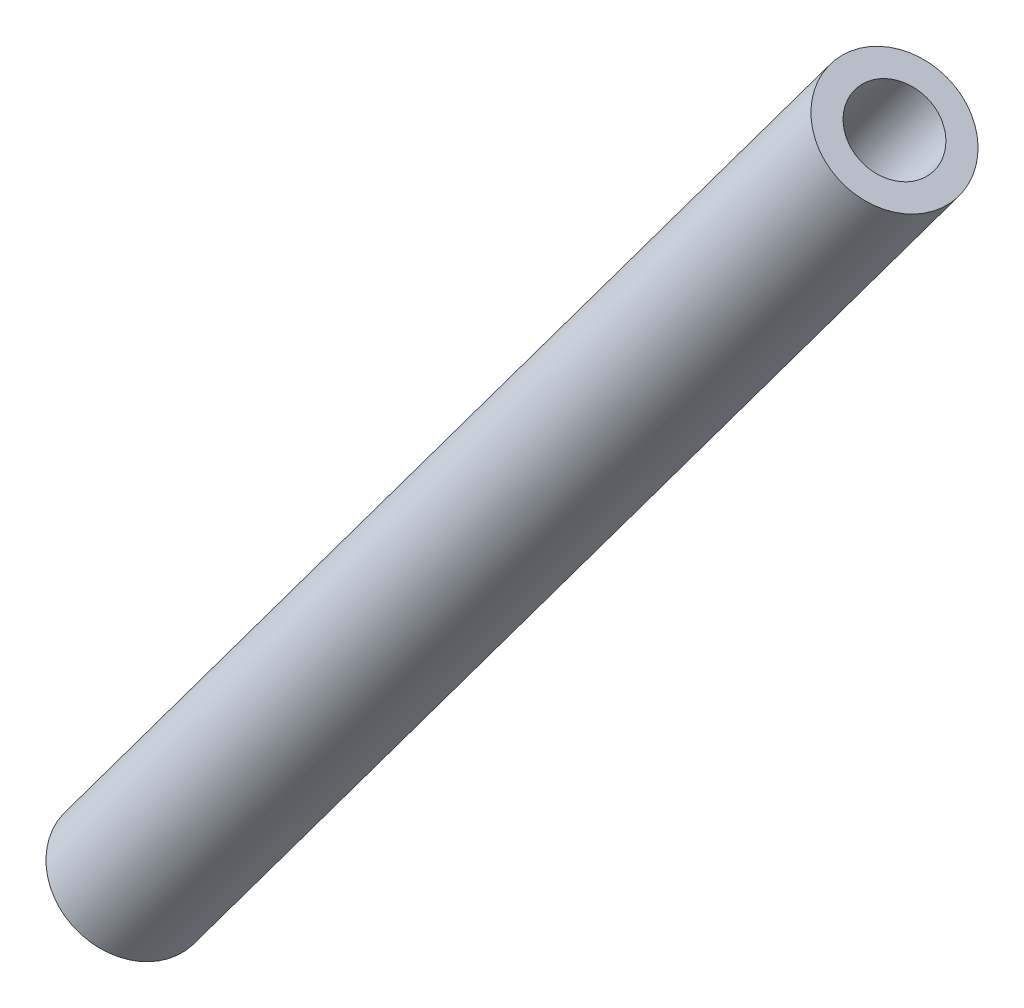
from build123d import *

# Parameters (mm, degrees)
SWEEP1_PROFILE_R     = 10.31875
CUT_SWEEP1_PROFILE_R = 6.35


with BuildPart() as part:
    # Sweep1: sweep along a curve in space
    with BuildLine() as sweep1_path:
        Line((0, 0, 0), (121.160535127, 163.12683632, 0))
    # Sweep1 profile (on start of the path) → Sweep1 (sweep)
    with BuildSketch(Plane(origin=(0, 0, 0), x_dir=(0.8027895488189021, -0.5962624760180233, 0), z_dir=(0.5962624760180233, 0.8027895488189021, 0))):
        Circle(SWEEP1_PROFILE_R)
    sweep(path=sweep1_path.line)

    # Cut-Sweep1: sweep along a curve in space
    with BuildLine() as cut_sweep1_path:
        Line((0, 0, 0), (121.160535127, 163.12683632, 0))
    # Cut-Sweep1 profile (on start of the path) → Cut-Sweep1 (sweep, cut)
    with BuildSketch(Plane(origin=(0, 0, 0), x_dir=(0.8027895488189021, -0.5962624760180233, 0), z_dir=(0.5962624760180233, 0.8027895488189021, 0))):
        Circle(CUT_SWEEP1_PROFILE_R)
    sweep(path=cut_sweep1_path.line, mode=Mode.SUBTRACT)


solid = part.part
